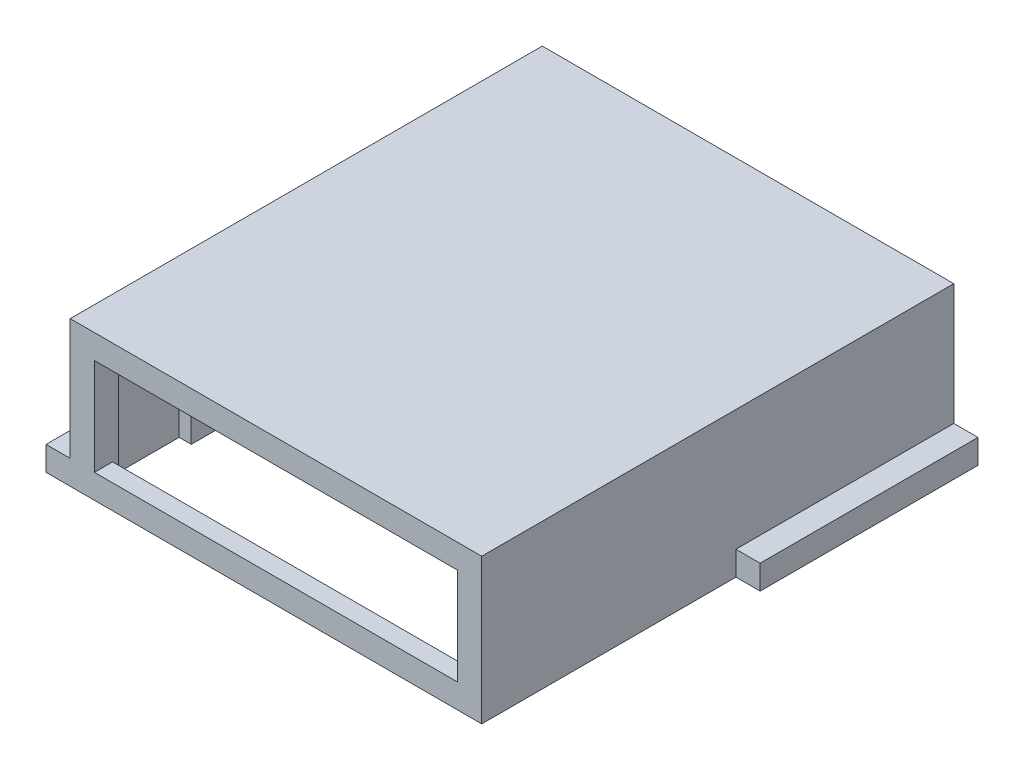
from build123d import *

# Parameters (mm, degrees)
SKETCH1_W           = 17
SKETCH1_H           = 19.5
BOSS_EXTRUDE1_DEPTH = 6
SKETCH2_W           = 15
SKETCH2_H           = 18
CUT_EXTRUDE1_DEPTH  = 5.2
SKETCH4_W           = 9
SKETCH4_H           = 1
BOSS_EXTRUDE2_DEPTH = 1
SKETCH3_W           = 9
SKETCH3_H           = 1
BOSS_EXTRUDE3_DEPTH = 1
SKETCH5_W           = 15
SKETCH5_H           = 4
CUT_EXTRUDE2_DEPTH  = 14
SKETCH6_W           = 16
SKETCH6_H           = 4
SKETCH6_H_2         = 3
CUT_EXTRUDE3_DEPTH  = 4


with BuildPart() as part:
    # Sketch1 → Boss-Extrude1 (new body)
    with BuildSketch(Plane(origin=(0, 0, 0), x_dir=(1, 0, 0), z_dir=(0, 1, 0))):
        with Locations((2.818181818, -1.568181818)):
            Rectangle(SKETCH1_W, SKETCH1_H)
    extrude(amount=BOSS_EXTRUDE1_DEPTH)

    # Sketch2 → Cut-Extrude1 (cut)
    with BuildSketch(Plane(origin=(0, 0, 0), x_dir=(1, 0, 0), z_dir=(0, 1, 0))):
        with Locations((2.818181818, -1.568181818)):
            Rectangle(SKETCH2_W, SKETCH2_H)
    extrude(amount=CUT_EXTRUDE1_DEPTH, mode=Mode.SUBTRACT)

    # Sketch4 → Boss-Extrude2 (add)
    with BuildSketch(Plane(origin=(11.318181818, 0, 0), x_dir=(0, 0, -1), z_dir=(1, 0, 0))):
        with Locations((3.681818182, 0.5)):
            Rectangle(SKETCH4_W, SKETCH4_H)
    extrude(amount=BOSS_EXTRUDE2_DEPTH)

    # Sketch3 → Boss-Extrude3 (add)
    with BuildSketch(Plane.ZY.offset(5.681818182)):
        with Locations((6.818181818, 0.5)):
            Rectangle(SKETCH3_W, SKETCH3_H)
    extrude(amount=BOSS_EXTRUDE3_DEPTH)

    # Sketch5 → Cut-Extrude2 (cut)
    with BuildSketch(Plane.XY.offset(11.318181818)):
        with Locations((2.818181818, 3)):
            Rectangle(SKETCH5_W, SKETCH5_H)
    extrude(amount=-CUT_EXTRUDE2_DEPTH, mode=Mode.SUBTRACT)

    # Sketch6 → Cut-Extrude3 (cut)
    with BuildSketch(Plane(origin=(0, 0, 0), x_dir=(1, 0, 0), z_dir=(0, 1, 0))):
        with Locations((2.818181818, 5.431818182)):
            Rectangle(SKETCH6_W, SKETCH6_H)
        with Locations((2.818181818, -8.818181818)):
            Rectangle(SKETCH6_W, SKETCH6_H_2)
    extrude(amount=CUT_EXTRUDE3_DEPTH, mode=Mode.SUBTRACT)


solid = part.part
